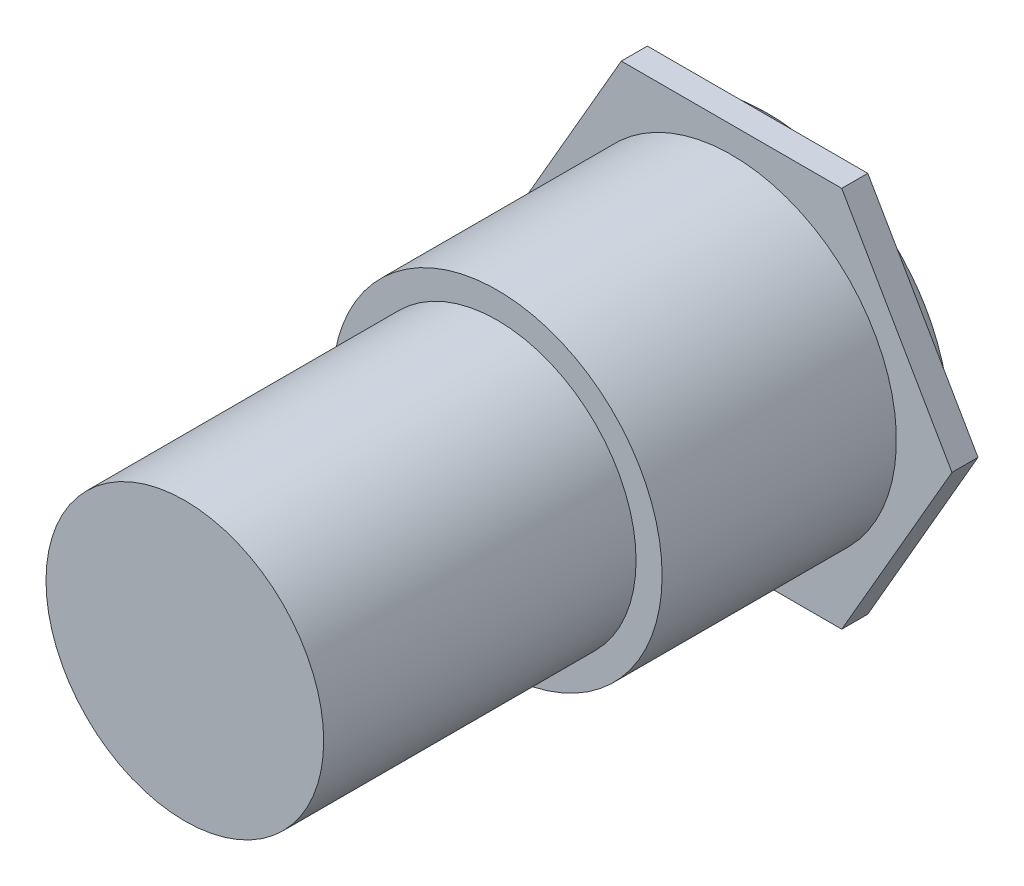
from build123d import *

# Parameters (mm, degrees)
SKETCH_1_R      = 9.5
EXTRUDE_1_DEPTH = 15
EXTRUDE_2_DEPTH = 1.5
SKETCH_4_R      = 8
EXTRUDE_3_DEPTH = 18


with BuildPart() as part:
    # 草图1 → 凸台-拉伸1 (new body)
    with BuildSketch(Plane.XY):
        Circle(SKETCH_1_R)
    extrude(amount=EXTRUDE_1_DEPTH)

    # 草图2 → 凸台-拉伸2 (add)
    with BuildSketch(Plane(origin=(0, 0, 0), x_dir=(-1, 0, 0), z_dir=(0, 0, -1))):
        Polygon((6.350852961, 11), (-6.350852961, 11), (-12.701705922, 0), (-6.350852961, -11), (6.350852961, -11), (12.701705922, 0), align=None)
    extrude(amount=-EXTRUDE_2_DEPTH)

    # 草图3 → 旋转1 (revolve)
    with BuildSketch(Plane(origin=(0, 0, 0), x_dir=(1, 0, 0), z_dir=(0, 1, 0))):
        with BuildLine():
            Line((0, 0), (0, 1.5))
            Line((0, 1.5), (-8.5, 1.5))
            ThreePointArc((-8.5, 1.5), (-9.924633098, 1.041055163), (-11, 0))
            Line((-11, 0), (0, 0))
        make_face()
    revolve(axis=Axis((0, 0, 0), (0, 0, -1)))

    # 草图4 → 凸台-拉伸3 (add)
    with BuildSketch(Plane.XY.offset(15)):
        Circle(SKETCH_4_R)
    extrude(amount=EXTRUDE_3_DEPTH)


solid = part.part
